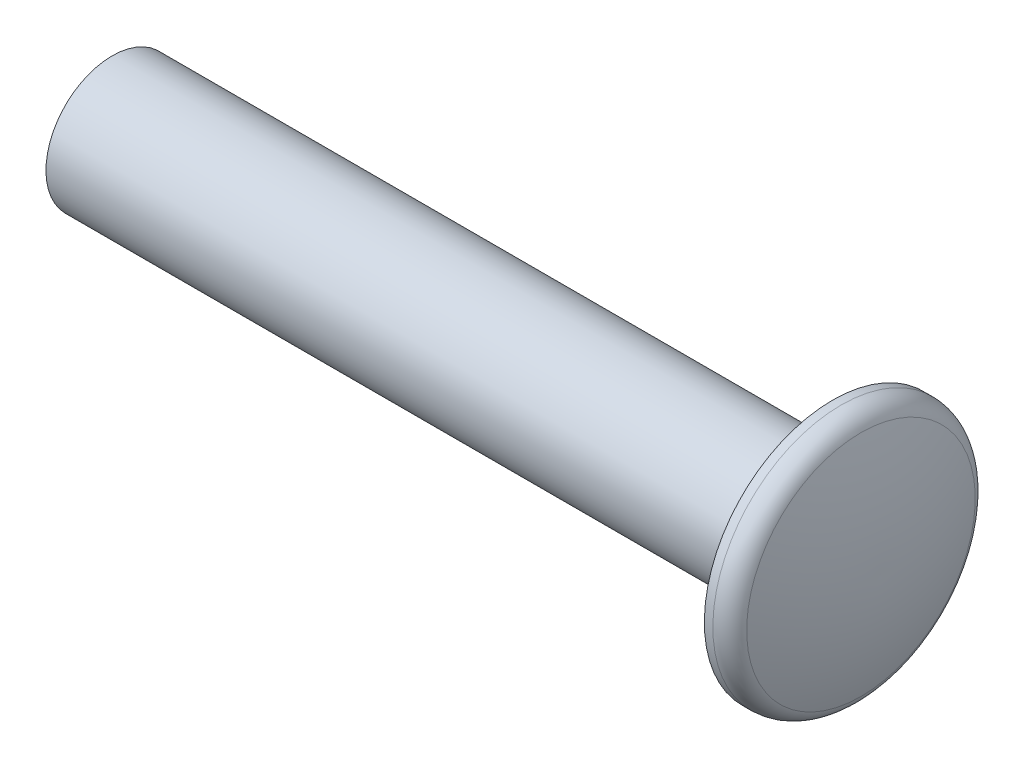
from build123d import *


with BuildPart() as part:
    # Sketch10 → Revolve1 (revolve)
    with BuildSketch(Plane(origin=(34.268160819, 0, 0), x_dir=(1, 0, 0), z_dir=(0, 0, 1)), mode=Mode.PRIVATE) as revolve1_sk:
        with BuildLine():
            Line((-24.170202084, -46.719786358), (19.009797916, -46.719786358))
            Line((19.009797916, -46.719786358), (19.009797916, -50.435793708))
            Line((19.009797916, -50.435793708), (19.519662653, -50.435793708))
            ThreePointArc((19.519662653, -50.435793708), (20.247428005, -50.206590322), (20.712506298, -49.601711175))
            ThreePointArc((20.712506298, -49.601711175), (21.604837682, -46.229461232), (21.867297916, -42.751036358))
            Line((21.867297916, -42.751036358), (-24.170202084, -42.751036358))
            Line((-24.170202084, -42.751036358), (-24.170202084, -46.719786358))
        make_face()
    revolve(revolve1_sk.sketch.rotate(Axis((56.135458735, -42.751036358, 0), (-1, 0, 0)), 180), axis=Axis((56.135458735, -42.751036358, 0), (-1, 0, 0)))


solid = part.part
